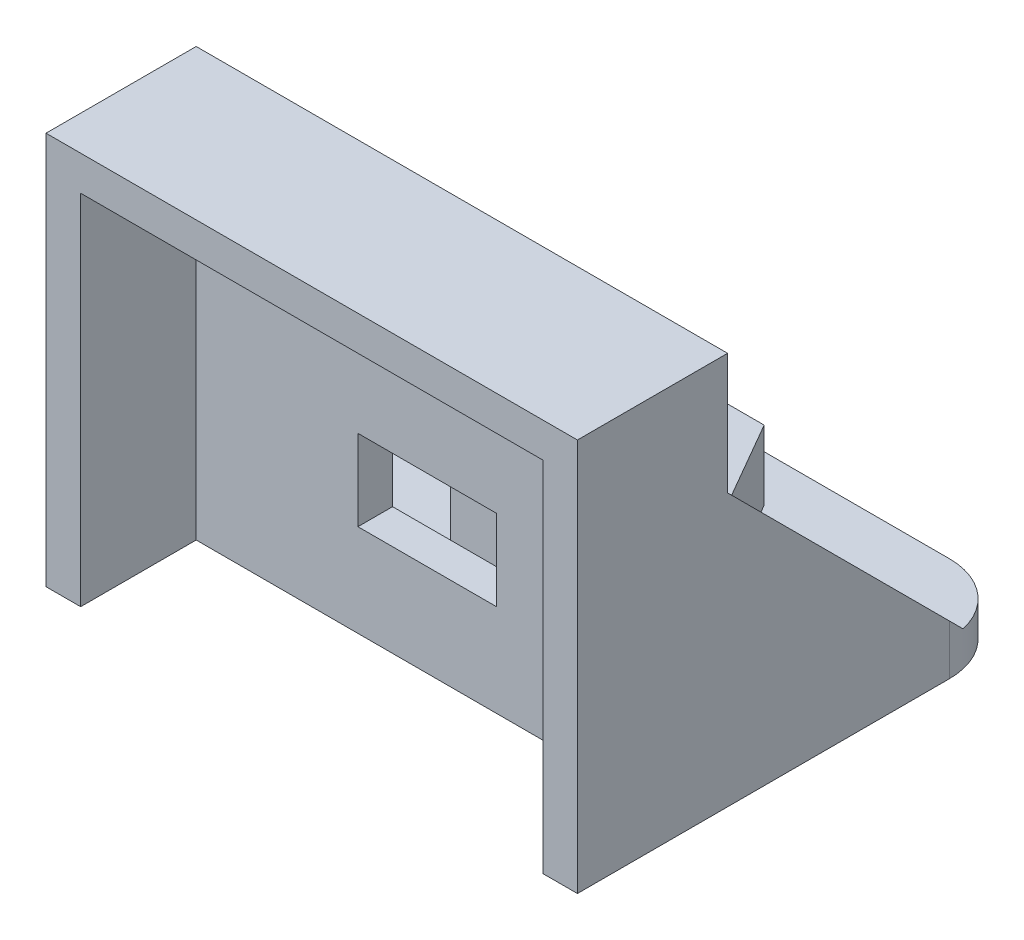
from build123d import *

# Parameters (mm, degrees)
SKETCH_1_W                  = 23
SKETCH_1_H                  = 17
EXTRUDE_1_DEPTH             = 6.5
SKETCH_2_W                  = 20
SKETCH_2_H                  = 15.5
CUT_EXTRUDE_1_DEPTH         = 5
SKETCH_3_W                  = 23
SKETCH_3_H                  = 1.5
EXTRUDE_2_DEPTH             = 12.6
EXTRUDE_3_DEPTH             = 3
EXTRUDE_6_REACH             = 21.397
SKETCH_7_W                  = 1.5
SKETCH_7_H                  = 7.259859141
EXTRUDE_6_DIRECTION_2_REACH = 21.397
HOLE_WIZARD_M3_1_D          = 3.2
FILLET_1_R                  = 3
CUT_EXTRUDE_2_REACH         = 21.059
SKETCH_10_W                 = 6
SKETCH_10_H                 = 3.5


with BuildPart() as part:
    # 草图1 → 凸台-拉伸1 (new body)
    with BuildSketch(Plane.XY):
        Rectangle(SKETCH_1_W, SKETCH_1_H)
    extrude(amount=EXTRUDE_1_DEPTH)

    # 草图2 → 切除-拉伸1 (cut)
    with BuildSketch(Plane.XY.offset(6.5)):
        with Locations((0, -0.75)):
            Rectangle(SKETCH_2_W, SKETCH_2_H)
    extrude(amount=-CUT_EXTRUDE_1_DEPTH, mode=Mode.SUBTRACT)

    # 草图3 → 凸台-拉伸2 (add)
    with BuildSketch(Plane(origin=(0, 0, 0), x_dir=(-1, 0, 0), z_dir=(0, 0, -1))):
        with Locations((0, -7.75)):
            Rectangle(SKETCH_3_W, SKETCH_3_H)
    extrude(amount=EXTRUDE_2_DEPTH)

    # 草图4 → 凸台-拉伸3 (add)
    with BuildSketch(Plane(origin=(0, -7, 0), x_dir=(1, 0, 0), z_dir=(0, 1, 0))):
        Polygon((4.965212315, 6.3), (2.482606158, 10.6), (-2.482606158, 10.6), (-4.965212315, 6.3), (-2.482606158, 2), (2.482606158, 2), align=None)
        Polygon((3.233161507, 6.3), (1.616580754, 9.1), (-1.616580754, 9.1), (-3.233161507, 6.3), (-1.616580754, 3.5), (1.616580754, 3.5), align=None, mode=Mode.SUBTRACT)
    extrude(amount=EXTRUDE_3_DEPTH)

    # 凸台-拉伸6: up to this face of the body (flat: up to its plane)
    extrude_6_end = Plane(part.part.faces().sort_by_distance((0, -7, -6.3))[0])
    # 草图7 → 凸台-拉伸6 (add, up to the picked face)
    with BuildSketch(Plane(origin=(0, -3.5, -3.5), x_dir=(-1, 0, 0), z_dir=(0, -0.7071067811865475, -0.7071067811865477)), mode=Mode.PRIVATE) as extrude_6_sk1:
        with Locations((-10.75, -1.319817897)):
            Rectangle(SKETCH_7_W, SKETCH_7_H)
    extrude_6_tool1 = split(extrude(extrude_6_sk1.sketch, amount=EXTRUDE_6_REACH, mode=Mode.PRIVATE), bisect_by=extrude_6_end, keep=Keep.BOTH, mode=Mode.PRIVATE)
    extrude_6 = extrude_6_tool1.solids().sort_by(Axis((10.75, -4.433252, -2.566748), (0, -0.7071067811865475, -0.7071067811865477)))[0]
    add(extrude_6)

    # 凸台-拉伸6 direction 2: up to this face of the body (flat: up to its plane)
    extrude_6_direction_2_end = Plane(part.part.faces().sort_by_distance((0, 0.75, 0))[0])
    # 草图7 → 凸台-拉伸6 direction 2 (add, up to the picked face)
    with BuildSketch(Plane(origin=(0, -3.5, -3.5), x_dir=(-1, 0, 0), z_dir=(0, -0.7071067811865475, -0.7071067811865477)), mode=Mode.PRIVATE) as extrude_6_direction_2_sk1:
        with Locations((-10.75, -1.319817897)):
            Rectangle(SKETCH_7_W, SKETCH_7_H)
    extrude_6_direction_2_tool1 = split(extrude(extrude_6_direction_2_sk1.sketch, amount=-EXTRUDE_6_DIRECTION_2_REACH, mode=Mode.PRIVATE), bisect_by=extrude_6_direction_2_end, keep=Keep.BOTH, mode=Mode.PRIVATE)
    extrude_6_direction_2 = extrude_6_direction_2_tool1.solids().sort_by(Axis((10.75, -4.433252, -2.566748), (0, 0.7071067811865475, 0.7071067811865477)))[0]
    add(extrude_6_direction_2)

    # 镜向1: 凸台-拉伸6, 凸台-拉伸6 direction 2 across plane
    add(extrude_6.mirror(Plane(origin=(0, 0, 0), x_dir=(0, 0, 1), z_dir=(1, 0, 0))))
    add(extrude_6_direction_2.mirror(Plane(origin=(0, 0, 0), x_dir=(0, 0, 1), z_dir=(1, 0, 0))))

    # M3 间隙孔1 (through all)
    with Locations(Plane(origin=(0, -7, 0), x_dir=(1, 0, 0), z_dir=(0, 1, 0))):
        with Locations((0, 6.3)):
            Hole(HOLE_WIZARD_M3_1_D / 2)

    # 圆角1
    fillet_1_edges = [part.edges().sort_by_distance(p)[0] for p in [
        (-11.5, -7.75, -12.6),
        (11.5, -7.75, -12.6),
    ]]
    fillet(fillet_1_edges, radius=FILLET_1_R)

    # 草图10 → 切除-拉伸2 (cut, up to next)
    with BuildSketch(Plane(origin=(0, 0, 0), x_dir=(-1, 0, 0), z_dir=(0, 0, -1)), mode=Mode.PRIVATE) as cut_extrude_2_sk1:
        with Locations((0, -2.75)):
            Rectangle(SKETCH_10_W, SKETCH_10_H)
    cut_extrude_2_tool1 = extrude(cut_extrude_2_sk1.sketch, amount=-CUT_EXTRUDE_2_REACH, mode=Mode.PRIVATE) & part.part
    add(cut_extrude_2_tool1.solids().sort_by_distance((0, -2.75, 0))[0], mode=Mode.SUBTRACT)


solid = part.part
